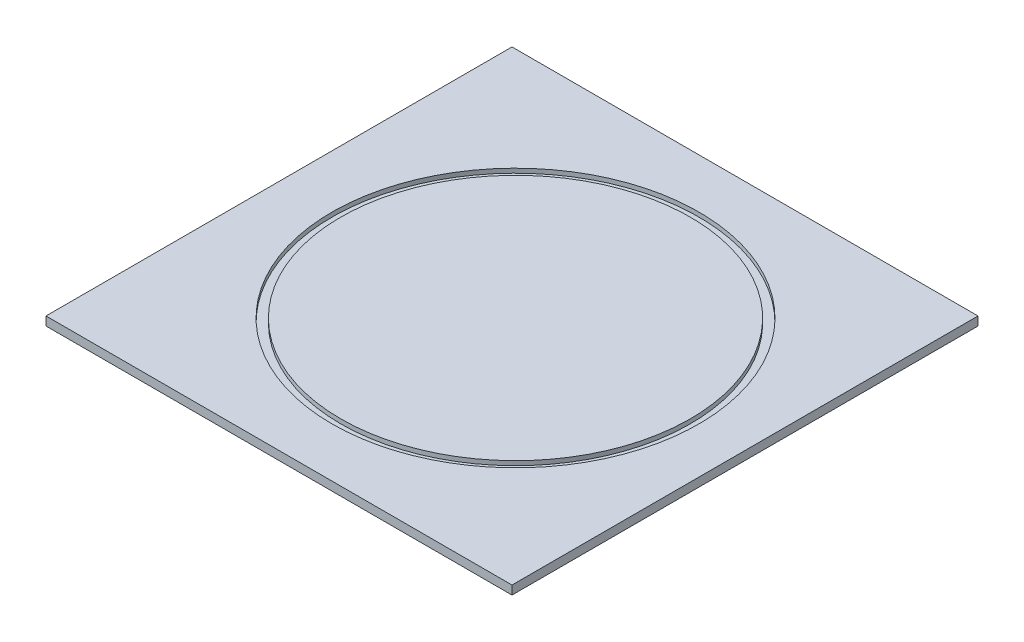
from build123d import *

# Parameters (mm, degrees)
SKETCH1_W           = 80
SKETCH1_H           = 80
BOSS_EXTRUDE2_DEPTH = 1.5
SKETCH2_R           = 31.5
SKETCH2_R_2         = 30
CUT_EXTRUDE2_DEPTH  = 0.75


with BuildPart() as part:
    # Sketch1 → Boss-Extrude2 (new body)
    with BuildSketch(Plane(origin=(0, 0, 0), x_dir=(1, 0, 0), z_dir=(0, 1, 0))):
        with Locations((-0.604095773, 0)):
            Rectangle(SKETCH1_W, SKETCH1_H)
    extrude(amount=BOSS_EXTRUDE2_DEPTH)

    # Sketch2 → Cut-Extrude2 (cut)
    with BuildSketch(Plane(origin=(0, 1.5, 0), x_dir=(1, 0, 0), z_dir=(0, 1, 0))):
        with Locations(Location((0, 0, 0), (0, 0, 270))):
            Circle(SKETCH2_R)
        with Locations(Location((0, 0, 0), (0, 0, 270))):
            Circle(SKETCH2_R_2, mode=Mode.SUBTRACT)
    extrude(amount=-CUT_EXTRUDE2_DEPTH, mode=Mode.SUBTRACT)


solid = part.part
